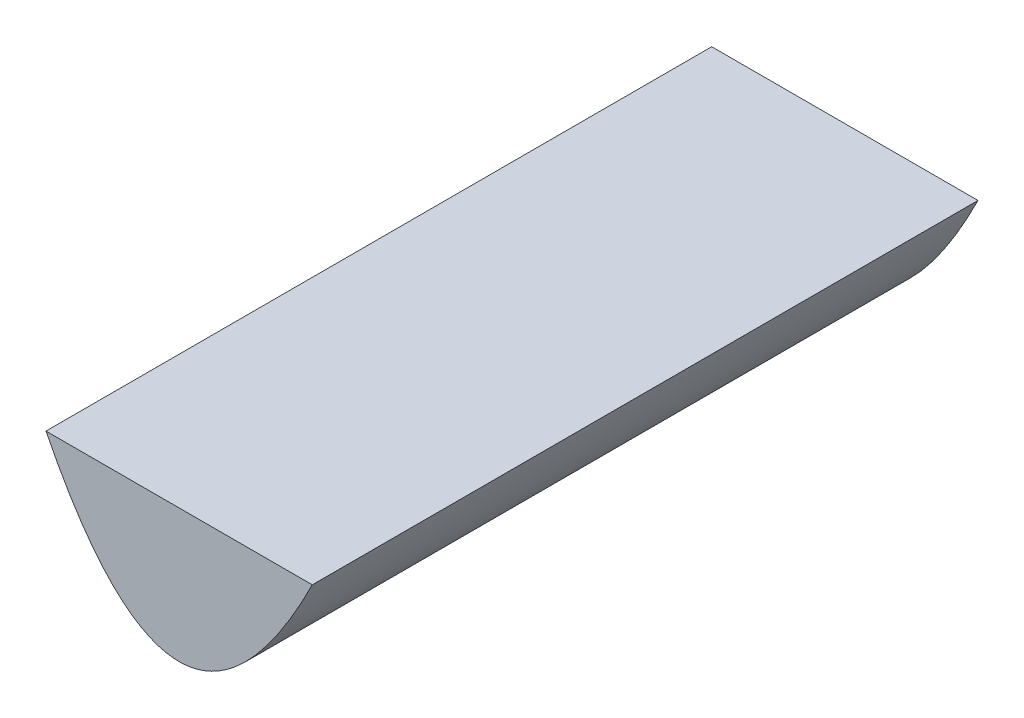
from build123d import *

# Parameters (mm, degrees)
SCALE1_SCALE = 1.318181818


with BuildPart() as part:
    # Sweep1: sweep along a path in Sketch2
    with BuildLine(Plane(origin=(0, 0, 0), x_dir=(0, 0, -1), z_dir=(1, 0, 0))) as sweep1_path:
        Line((250, 0), (-250, 0))
    # Sketch1 → Sweep1 (sweep)
    with BuildSketch(Plane.XY):
        with BuildLine():
            Line((-100, 100), (100, 100))
            add(Edge.make_bspline(
                [(-100, 100), (0, -100), (100, 100)],
                knots=[0.274263765, 0.274263765, 0.274263765, 0.725736235, 0.725736235, 0.725736235], degree=2))
        make_face()
    sweep(path=sweep1_path.line)


with BuildPart() as part_1:
    # Scale1: scaled about (0, 60, 0)
    add(part.part.scale(SCALE1_SCALE).moved(Location((0, -19.090909091, 0))))


solid = part_1.part
